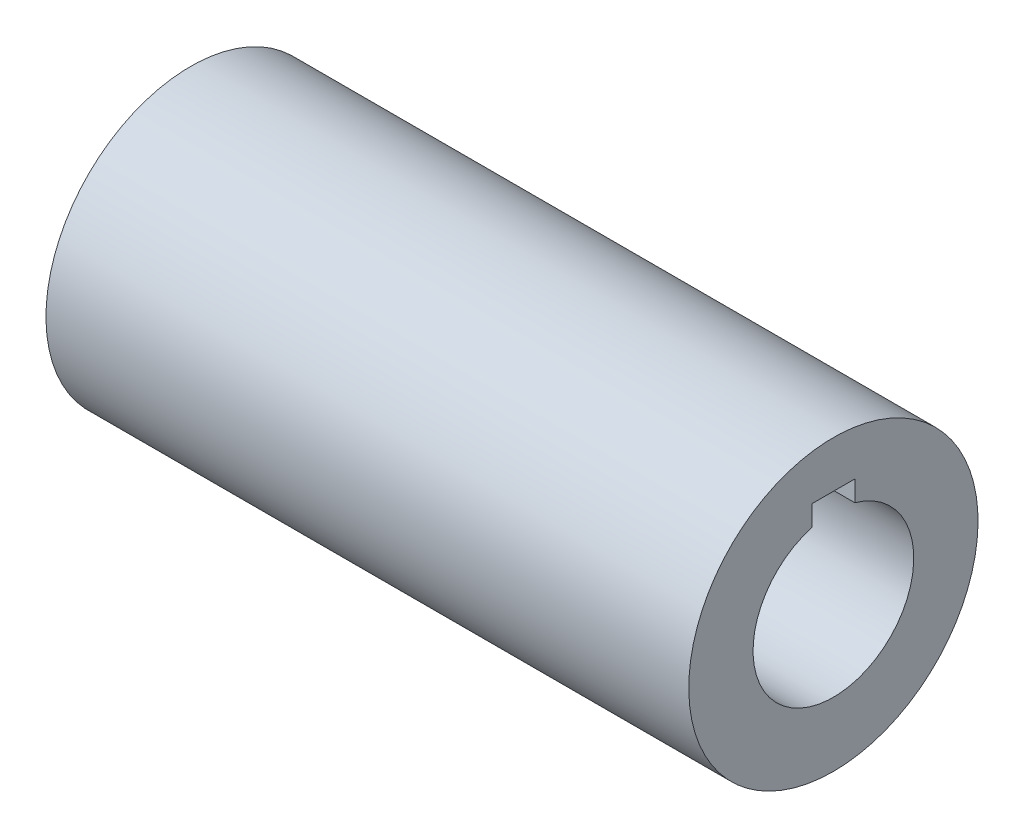
from build123d import *

# Parameters (mm, degrees)
SKETCH1_W          = 120
SKETCH1_H          = 12
SKETCH2_W          = 120
SKETCH2_H          = 8
CUT_EXTRUDE1_DEPTH = 18.3


with BuildPart() as part:
    # Sketch1 → Revolve1 (revolve)
    with BuildSketch(Plane.XY, mode=Mode.PRIVATE) as revolve1_sk:
        with Locations((0, 21)):
            Rectangle(SKETCH1_W, SKETCH1_H)
    revolve(revolve1_sk.sketch.rotate(Axis((-60, 0, 0), (1, 0, 0)), 180), axis=Axis((-60, 0, 0), (1, 0, 0)))

    # Sketch2 → Cut-Extrude1 (cut)
    with BuildSketch(Plane(origin=(0, 0, 0), x_dir=(1, 0, 0), z_dir=(0, 1, 0))):
        Rectangle(SKETCH2_W, SKETCH2_H)
    extrude(amount=CUT_EXTRUDE1_DEPTH, mode=Mode.SUBTRACT)


solid = part.part
